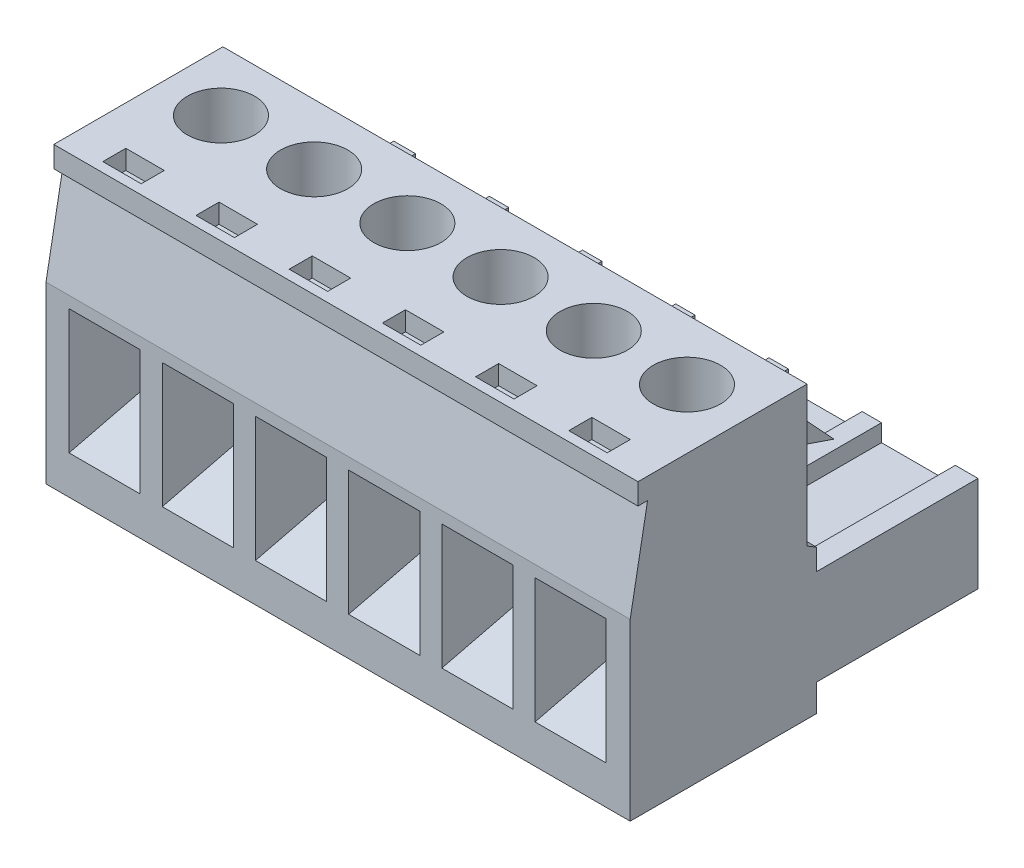
from build123d import *

# Parameters (mm, degrees)
BOSS_EXTRUDE1_DEPTH                     = 15.2
BOSS_EXTRUDE2_DEPTH                     = 8.4
LPATTERN1_COUNT                         = 6
LPATTERN1_PITCH                         = 4.85
CUT_EXTRUDE1_DEPTH                      = 3
LPATTERN2_COUNT                         = 5
LPATTERN2_PITCH                         = 4.85
SKETCH14_3_W                            = 3.3
SKETCH14_3_H                            = 3.1
CUT_EXTRUDE2_DEPTH                      = 3
LPATTERN3_COUNT                         = 6
LPATTERN3_PITCH                         = 4.85
BOSS_EXTRUDE3_START                     = -5
BOSS_EXTRUDE3_DEPTH                     = 1.5
CBORE_FOR_M5_HEX_HEAD_BOLT2_D           = 2
CBORE_FOR_M5_HEX_HEAD_BOLT2_DEPTH       = 8.8
CBORE_FOR_M5_HEX_HEAD_BOLT2_CBORE_D     = 3.5
CBORE_FOR_M5_HEX_HEAD_BOLT2_CBORE_DEPTH = 3
LPATTERN4_COUNT                         = 6
LPATTERN4_PITCH                         = 4.85
CUT_EXTRUDE4_START                      = -1.3
CUT_EXTRUDE4_DEPTH                      = 1.5
SKETCH20_W                              = 2
SKETCH20_H                              = 1.2
CUT_EXTRUDE5_DEPTH                      = 1


with BuildPart() as part:
    # Sketch1 → Boss-Extrude1 (new, symmetric)
    with BuildSketch(Plane(origin=(0, 0, 0), x_dir=(0, 0, -1), z_dir=(1, 0, 0))):
        Polygon((0, 0), (0, -1.1), (0.5, -1.1), (-0.405025253, -6), (-0.405025253, -15.1), (9.294974747, -15.1), (9.294974747, -7.6), (8.8, -7.3), (8.8, 0), align=None)
    extrude(amount=BOSS_EXTRUDE1_DEPTH, both=True)

    # Sketch6 → Boss-Extrude2 (add)
    with BuildSketch(Plane(origin=(0, 0, -9.294974747), x_dir=(-1, 0, 0), z_dir=(0, 0, -1))):
        with BuildLine():
            Line((-15.2, -8.7), (-14.020470594, -8.7))
            Line((-14.020470594, -8.7), (-14.020470594, -9.6))
            Line((-14.020470594, -9.6), (-10.179529406, -9.6))
            Line((-10.179529406, -9.6), (-10.179529406, -8.7))
            Line((-10.179529406, -8.7), (-9.170470594, -8.7))
            Line((-9.170470594, -8.7), (-9.170470594, -9.6))
            Line((-9.170470594, -9.6), (-5.329529406, -9.6))
            Line((-5.329529406, -9.6), (-5.329529406, -8.7))
            Line((-5.329529406, -8.7), (-4.320470594, -8.7))
            Line((-4.320470594, -8.7), (-4.320470594, -9.6))
            Line((-4.320470594, -9.6), (-0.479529406, -9.6))
            Line((-0.479529406, -9.6), (-0.479529406, -8.7))
            Line((-0.479529406, -8.7), (0.529529406, -8.7))
            Line((0.529529406, -8.7), (0.529529406, -9.6))
            Line((0.529529406, -9.6), (4.370470594, -9.6))
            Line((4.370470594, -9.6), (4.370470594, -8.7))
            Line((4.370470594, -8.7), (5.379529406, -8.7))
            Line((5.379529406, -8.7), (5.379529406, -9.6))
            Line((5.379529406, -9.6), (9.220470594, -9.6))
            Line((9.220470594, -9.6), (9.220470594, -8.7))
            Line((9.220470594, -8.7), (10.229529406, -8.7))
            Line((10.229529406, -8.7), (10.229529406, -9.6))
            Line((10.229529406, -9.6), (14.070470594, -9.6))
            Line((14.070470594, -9.6), (14.070470594, -8.7))
            Line((14.070470594, -8.7), (15.2, -8.7))
            Line((15.2, -8.7), (15.2, -13.67968284))
            Line((15.2, -13.67968284), (13.871894098, -13.67968284))
            ThreePointArc((13.871894098, -13.67968284), (12.15, -14.3), (10.428105902, -13.67968284))
            Line((10.428105902, -13.67968284), (9.021894098, -13.67968284))
            ThreePointArc((9.021894098, -13.67968284), (7.3, -14.3), (5.578105902, -13.67968284))
            Line((5.578105902, -13.67968284), (4.171894098, -13.67968284))
            ThreePointArc((4.171894098, -13.67968284), (2.45, -14.3), (0.728105902, -13.67968284))
            Line((0.728105902, -13.67968284), (-0.678105902, -13.67968284))
            ThreePointArc((-0.678105902, -13.67968284), (-2.4, -14.3), (-4.121894098, -13.67968284))
            Line((-4.121894098, -13.67968284), (-5.528105902, -13.67968284))
            ThreePointArc((-5.528105902, -13.67968284), (-7.25, -14.3), (-8.971894098, -13.67968284))
            Line((-8.971894098, -13.67968284), (-10.378105902, -13.67968284))
            ThreePointArc((-10.378105902, -13.67968284), (-12.1, -14.3), (-13.821894098, -13.67968284))
            Line((-13.821894098, -13.67968284), (-15.2, -13.67968284))
            Line((-15.2, -13.67968284), (-15.2, -8.7))
        make_face()
    extrude(amount=BOSS_EXTRUDE2_DEPTH)

    # Sketch11 → CBORE for M5 Hex Head Bolt1 (revolve, cut)
    with BuildSketch(Plane(origin=(12.1, -11.6, -17.694974747), x_dir=(0, 1, 0), z_dir=(1, 0, 0))):
        Polygon((0, 0), (0, 8.70043031), (0.5, 8.4), (0.5, 3), (1.5, 3), (1.5, 0), align=None)
    cbore_for_m5_hex_head_bolt1 = revolve(axis=Axis((12.1, -11.6, -24.044974747), (0, 0, 1)), mode=Mode.SUBTRACT)

    # LPattern1: CBORE for M5 Hex Head Bolt1 ×6
    with Locations(*[(-i * LPATTERN1_PITCH, 0, 0) for i in range(1, LPATTERN1_COUNT)]):
        add(cbore_for_m5_hex_head_bolt1, mode=Mode.SUBTRACT)

    # Sketch12 → Cut-Extrude1 (cut)
    with BuildSketch(Plane(origin=(0, 0, -17.694974747), x_dir=(-1, 0, 0), z_dir=(0, 0, -1))):
        with BuildLine():
            Line((-10.630306154, -13.1), (-8.719693846, -13.1))
            ThreePointArc((-8.719693846, -13.1), (-9.339010392, -11.814559042), (-8.993918739, -10.430065202))
            Line((-8.993918739, -10.430065202), (-9.675, -9.973151327))
            Line((-9.675, -9.973151327), (-10.356081261, -10.430065202))
            ThreePointArc((-10.356081261, -10.430065202), (-10.010989608, -11.814559042), (-10.630306154, -13.1))
        make_face()
    cut_extrude1 = extrude(amount=-CUT_EXTRUDE1_DEPTH, mode=Mode.SUBTRACT)

    # LPattern2: Cut-Extrude1 ×5
    with Locations(*[(-i * LPATTERN2_PITCH, 0, 0) for i in range(1, LPATTERN2_COUNT)]):
        add(cut_extrude1, mode=Mode.SUBTRACT)

    # Sketch14 → Cut-Loft1 section 0
    with BuildSketch(Plane.XY.offset(-3.494974747)):
        with BuildLine():
            Line((-13.8, -8.8), (-10.5, -8.8))
            Line((-10.5, -8.8), (-10.5, -11.9))
            Line((-10.5, -11.9), (-13.8, -11.9))
            Line((-13.8, -11.9), (-13.8, -8.8))
        make_face()
    # Sketch13 → Cut-Loft1 section 1
    with BuildSketch(Plane.XY.offset(0.405025253)):
        with BuildLine():
            Line((-14, -6.6), (-10.3, -6.6))
            Line((-10.3, -6.6), (-10.3, -13.1))
            Line((-10.3, -13.1), (-14, -13.1))
            Line((-14, -13.1), (-14, -6.6))
        make_face()
    cut_loft1 = loft(mode=Mode.SUBTRACT)

    # Sketch14<3> → Cut-Extrude2 (cut)
    with BuildSketch(Plane.XY.offset(-3.494974747)):
        with Locations((-12.15, -10.35)):
            Rectangle(SKETCH14_3_W, SKETCH14_3_H)
    cut_extrude2 = extrude(amount=-CUT_EXTRUDE2_DEPTH, mode=Mode.SUBTRACT)

    # LPattern3: Cut-Loft1, Cut-Extrude2 ×6
    with Locations(*[(i * LPATTERN3_PITCH, 0, 0) for i in range(1, LPATTERN3_COUNT)]):
        add(cut_loft1, mode=Mode.SUBTRACT)
        add(cut_extrude2, mode=Mode.SUBTRACT)

    # Sketch15 → Boss-Extrude3 (add)
    with BuildSketch(Plane(origin=(15.2, 0, 0), x_dir=(0, 0, -1), z_dir=(1, 0, 0)).offset(BOSS_EXTRUDE3_START)):
        Polygon((8.8, -6.2), (12.292132748, -6.2), (13.694974747, -6.681595664), (12.133628336, -4.992750678), (8.8, -4.8), align=None)
    boss_extrude3 = extrude(amount=BOSS_EXTRUDE3_DEPTH)

    # Mirror1: Boss-Extrude3 across plane
    add(boss_extrude3.mirror(Plane(origin=(0, 0, 0), x_dir=(0, 0, 1), z_dir=(1, 0, 0))))

    # CBORE for M5 Hex Head Bolt2
    with Locations(Plane(origin=(0, 0, 0), x_dir=(1, 0, 0), z_dir=(0, 1, 0))):
        with Locations((-12.15, 5.65)):
            cbore_for_m5_hex_head_bolt2 = CounterBoreHole(CBORE_FOR_M5_HEX_HEAD_BOLT2_D / 2, CBORE_FOR_M5_HEX_HEAD_BOLT2_CBORE_D / 2, CBORE_FOR_M5_HEX_HEAD_BOLT2_CBORE_DEPTH, depth=CBORE_FOR_M5_HEX_HEAD_BOLT2_DEPTH)

    # LPattern4: CBORE for M5 Hex Head Bolt2 ×6
    with Locations(*[(i * LPATTERN4_PITCH, 0, 0) for i in range(1, LPATTERN4_COUNT)]):
        add(cbore_for_m5_hex_head_bolt2, mode=Mode.SUBTRACT)

    # Sketch19 → Cut-Extrude4 (cut)
    with BuildSketch(Plane(origin=(0, 0, 0), x_dir=(1, 0, 0), z_dir=(0, 1, 0)).offset(CUT_EXTRUDE4_START)):
        with BuildLine():
            Line((-14.7, 8.8), (14.7, 8.8))
            Line((14.7, 8.8), (14.7, 6.3))
            Line((14.7, 6.3), (14.254065923, 6.3))
            ThreePointArc((14.254065923, 6.3), (12.1, 7.9), (9.945934077, 6.3))
            Line((9.945934077, 6.3), (9.404065923, 6.3))
            ThreePointArc((9.404065923, 6.3), (7.25, 7.9), (5.095934077, 6.3))
            Line((5.095934077, 6.3), (4.554065923, 6.3))
            ThreePointArc((4.554065923, 6.3), (2.4, 7.9), (0.245934077, 6.3))
            Line((0.245934077, 6.3), (-0.295934077, 6.3))
            ThreePointArc((-0.295934077, 6.3), (-2.45, 7.9), (-4.604065923, 6.3))
            Line((-4.604065923, 6.3), (-5.145934077, 6.3))
            ThreePointArc((-5.145934077, 6.3), (-7.3, 7.9), (-9.454065923, 6.3))
            Line((-9.454065923, 6.3), (-9.995934077, 6.3))
            ThreePointArc((-9.995934077, 6.3), (-12.15, 7.9), (-14.304065923, 6.3))
            Line((-14.304065923, 6.3), (-14.7, 6.3))
            Line((-14.7, 6.3), (-14.7, 8.8))
        make_face()
    extrude(amount=-CUT_EXTRUDE4_DEPTH, mode=Mode.SUBTRACT)

    # Sketch20 → Cut-Extrude5 (cut)
    with BuildSketch(Plane(origin=(0, 0, 0), x_dir=(1, 0, 0), z_dir=(0, 1, 0))):
        with Locations((-12.15, 1.1)):
            Rectangle(SKETCH20_W, SKETCH20_H)
        with Locations((-7.3, 1.1)):
            Rectangle(SKETCH20_W, SKETCH20_H)
        with Locations((-2.45, 1.1)):
            Rectangle(SKETCH20_W, SKETCH20_H)
        with Locations((2.4, 1.1)):
            Rectangle(SKETCH20_W, SKETCH20_H)
        with Locations((7.25, 1.1)):
            Rectangle(SKETCH20_W, SKETCH20_H)
        with Locations((12.1, 1.1)):
            Rectangle(SKETCH20_W, SKETCH20_H)
    extrude(amount=-CUT_EXTRUDE5_DEPTH, mode=Mode.SUBTRACT)


solid = part.part
